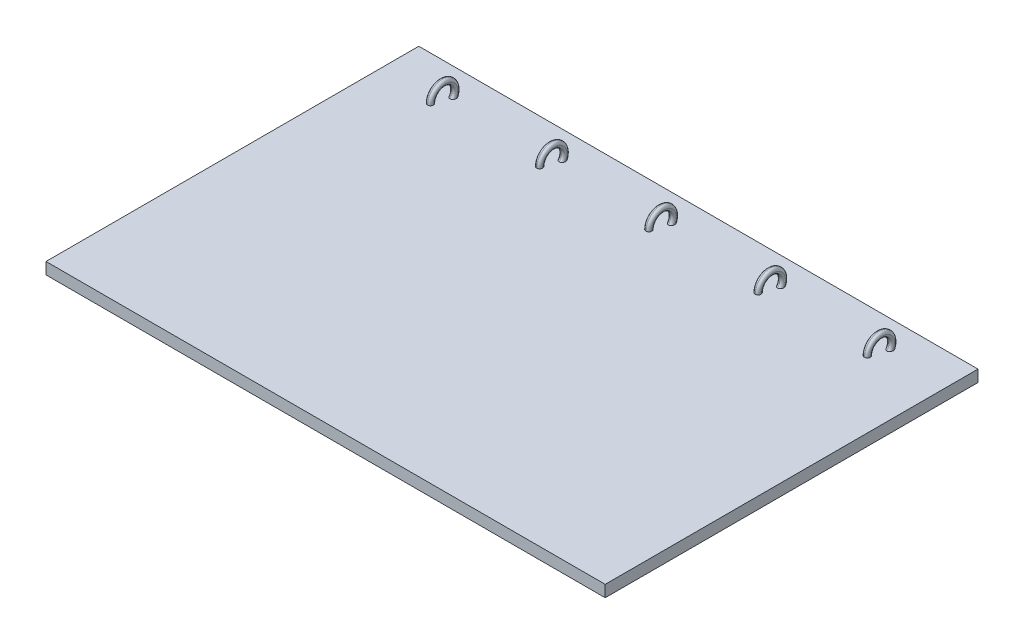
from build123d import *

# Parameters (mm, degrees)
SKETCH1_W           = 101.6
SKETCH1_H           = 3.175
BOSS_EXTRUDE1_DEPTH = 76.2
SKETCH2_W           = 15.875
SKETCH2_H           = 6.110286864
SKETCH2_H_2         = 2.144713136
SKETCH2_W_2         = 28.178125
CUT_EXTRUDE1_DEPTH  = 92.759147909
FILLET1_R           = 0.762


with BuildPart() as part:
    # Sketch1 → Boss-Extrude1 (new, symmetric)
    with BuildSketch(Plane(origin=(0, 0, 0), x_dir=(0, 0, -1), z_dir=(1, 0, 0))):
        with Locations((0, 1.5875)):
            Rectangle(SKETCH1_W, SKETCH1_H)
        with BuildLine():
            ThreePointArc((38.1, 4.7625), (41.481225702, 7.159151689), (42.622786864, 3.175))
            Line((42.622786864, 3.175), (44.45, 3.175))
            ThreePointArc((44.45, 3.175), (41.449469348, 8.809846739), (36.5125, 4.7625))
            Line((36.5125, 4.7625), (38.1, 4.7625))
        make_face()
    extrude(amount=BOSS_EXTRUDE1_DEPTH, both=True)

    # Sketch2 → Cut-Extrude1 (cut, through all)
    with BuildSketch(Plane(origin=(0, 3.175, 0), x_dir=(1, 0, 0), z_dir=(0, 1, 0))):
        with Locations((68.2625, 39.567643432)):
            Rectangle(SKETCH2_W, SKETCH2_H)
        with Locations((68.2625, 43.695143432)):
            Rectangle(SKETCH2_W, SKETCH2_H_2)
        with Locations((44.6484375, 39.567643432)):
            Rectangle(SKETCH2_W_2, SKETCH2_H)
        with Locations((44.6484375, 43.695143432)):
            Rectangle(SKETCH2_W_2, SKETCH2_H_2)
        with Locations((14.8828125, 39.567643432)):
            Rectangle(SKETCH2_W_2, SKETCH2_H)
        with Locations((14.8828125, 43.695143432)):
            Rectangle(SKETCH2_W_2, SKETCH2_H_2)
        with Locations((-14.8828125, 39.567643432)):
            Rectangle(SKETCH2_W_2, SKETCH2_H)
        with Locations((-14.8828125, 43.695143432)):
            Rectangle(SKETCH2_W_2, SKETCH2_H_2)
        with Locations((-44.6484375, 39.567643432)):
            Rectangle(SKETCH2_W_2, SKETCH2_H)
        with Locations((-44.6484375, 43.695143432)):
            Rectangle(SKETCH2_W_2, SKETCH2_H_2)
        with Locations((-68.2625, 39.567643432)):
            Rectangle(SKETCH2_W, SKETCH2_H)
        with Locations((-68.2625, 43.695143432)):
            Rectangle(SKETCH2_W, SKETCH2_H_2)
    extrude(amount=CUT_EXTRUDE1_DEPTH, mode=Mode.SUBTRACT)

    # Fillet1
    fillet1_edges = [part.edges().sort_by_distance(p)[0] for p in [
        (30.559375, 8.809846739, -41.449469348),
        (58.7375, 8.809846739, -41.449469348),
        (58.7375, 7.159151689, -41.481225702),
        (30.559375, 7.159151689, -41.481225702),
        (28.971875, 8.809846739, -41.449469348),
        (28.971875, 7.159151689, -41.481225702),
        (0.79375, 8.809846739, -41.449469348),
        (0.79375, 7.159151689, -41.481225702),
        (-28.971875, 8.809846739, -41.449469348),
        (-0.79375, 8.809846739, -41.449469348),
        (-28.971875, 7.159151689, -41.481225702),
        (-0.79375, 7.159151689, -41.481225702),
        (-30.559375, 8.809846739, -41.449469348),
        (-30.559375, 7.159151689, -41.481225702),
        (-58.7375, 8.809846739, -41.449469348),
        (-58.7375, 7.159151689, -41.481225702),
        (-60.325, 8.809846739, -41.449469348),
        (-60.325, 7.159151689, -41.481225702),
        (60.325, 8.809846739, -41.449469348),
        (60.325, 7.159151689, -41.481225702),
    ]]
    fillet(fillet1_edges, radius=FILLET1_R)


solid = part.part
